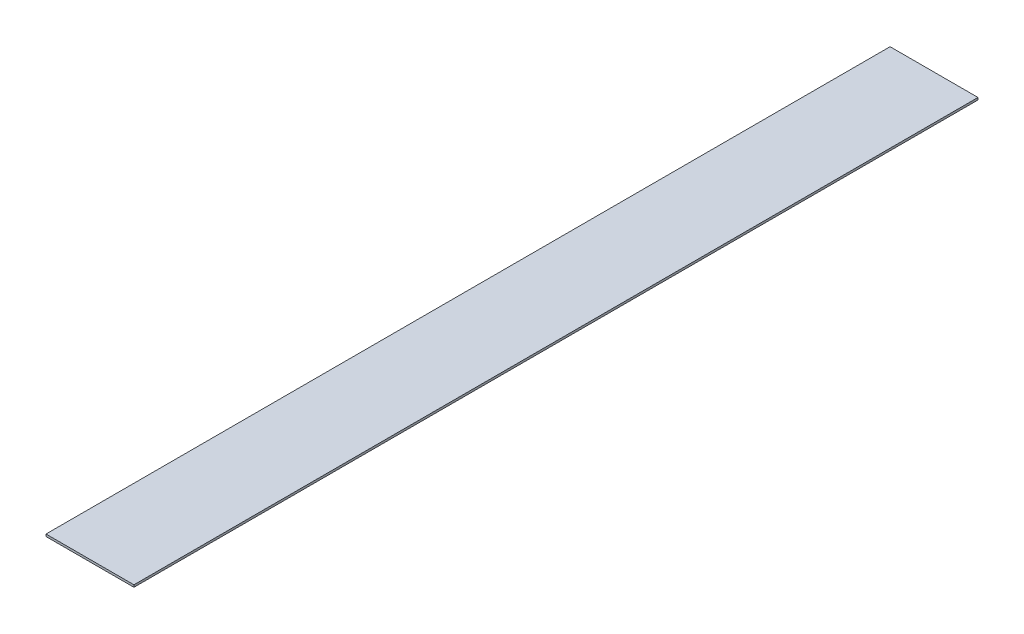
from build123d import *

# Parameters (mm, degrees)
SKETCH_1_W      = 200
SKETCH_1_H      = 5
EXTRUDE_1_DEPTH = 960


with BuildPart() as part:
    # Эскиз1 → Бобышка-Вытянуть1 (new, symmetric)
    with BuildSketch(Plane.XY):
        Rectangle(SKETCH_1_W, SKETCH_1_H)
    extrude(amount=EXTRUDE_1_DEPTH, both=True)


solid = part.part
